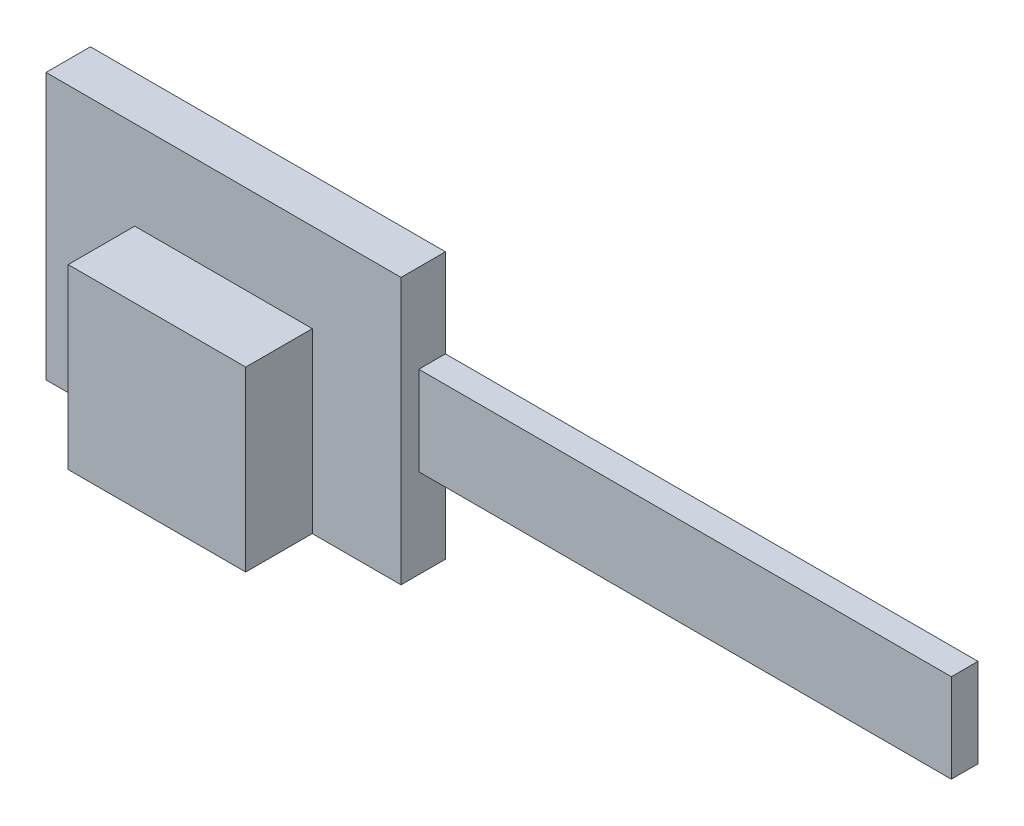
from build123d import *

# Parameters (mm, degrees)
SKETCH1_W           = 8
SKETCH1_H           = 6
BOSS_EXTRUDE1_DEPTH = 1
SKETCH2_W           = 4
SKETCH2_H           = 4
BOSS_EXTRUDE2_DEPTH = 1.5
SKETCH3_W           = 12
SKETCH3_H           = 2
BOSS_EXTRUDE3_DEPTH = 0.6


with BuildPart() as part:
    # Sketch1 → Boss-Extrude1 (new body)
    with BuildSketch(Plane.XY):
        Rectangle(SKETCH1_W, SKETCH1_H)
    extrude(amount=BOSS_EXTRUDE1_DEPTH)

    # Sketch2 → Boss-Extrude2 (add)
    with BuildSketch(Plane.XY.offset(1)):
        with Locations((0, -1)):
            Rectangle(SKETCH2_W, SKETCH2_H)
    extrude(amount=BOSS_EXTRUDE2_DEPTH)


with BuildPart() as body_2:
    # Sketch3 → Boss-Extrude3 (new body)
    with BuildSketch(Plane(origin=(0, 0, 0), x_dir=(-1, 0, 0), z_dir=(0, 0, -1))):
        with Locations((-10, 0.007571997)):
            Rectangle(SKETCH3_W, SKETCH3_H)
    extrude(amount=-BOSS_EXTRUDE3_DEPTH)


solid = Compound([part.part, body_2.part])
